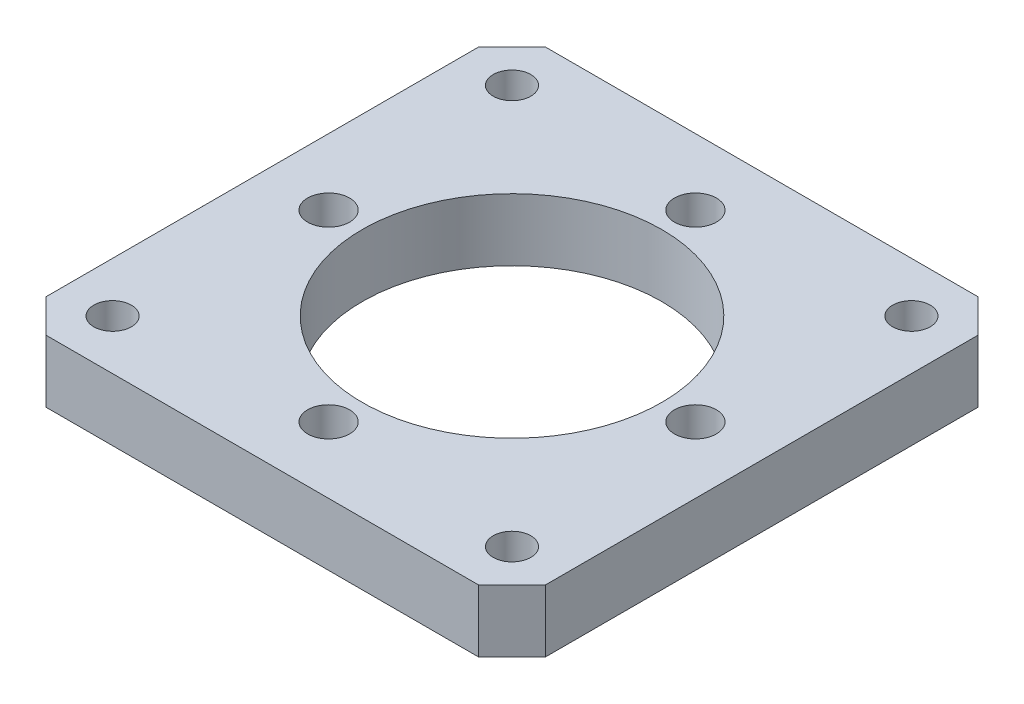
from build123d import *

# Parameters (mm, degrees)
SKETCH1_W           = 38.1
SKETCH1_H           = 38.1
SKETCH1_R           = 11.43
BOSS_EXTRUDE1_DEPTH = 4.7625
SKETCH2_R           = 1.6002
SKETCH2_R_2         = 1.4351
CUT_EXTRUDE1_DEPTH  = 28.358479604
CIRPATTERN1_COUNT   = 4
CHAMFER1_SIZE       = 2.54


with BuildPart() as part:
    # Sketch1 → Boss-Extrude1 (new body)
    with BuildSketch(Plane(origin=(0, 0, 0), x_dir=(1, 0, 0), z_dir=(0, 1, 0))):
        Rectangle(SKETCH1_W, SKETCH1_H)
        with Locations(Location((0, 0, 0), (0, 0, 90))):
            Circle(SKETCH1_R, mode=Mode.SUBTRACT)
    extrude(amount=BOSS_EXTRUDE1_DEPTH)

    # Sketch2 → Cut-Extrude1 (cut, through all)
    with BuildSketch(Plane(origin=(0, 4.7625, 0), x_dir=(1, 0, 0), z_dir=(0, 1, 0))):
        with Locations(Location((0, 13.9954, 0), (0, 0, 270))):
            Circle(SKETCH2_R)
        with Locations(Location((15.24, 15.24, 0), (0, 0, 270))):
            Circle(SKETCH2_R_2)
    cut_extrude1 = extrude(amount=-CUT_EXTRUDE1_DEPTH, mode=Mode.SUBTRACT)

    # CirPattern1: Cut-Extrude1 ×4 about axis
    cirpattern1_axis = Axis((0, 0, 0), (0, 1, 0))
    for i in range(1, CIRPATTERN1_COUNT):
        add(cut_extrude1.rotate(cirpattern1_axis, i * 360 / CIRPATTERN1_COUNT), mode=Mode.SUBTRACT)

    # Chamfer1
    chamfer1_edges = [part.edges().sort_by_distance(p)[0] for p in [
        (19.05, 2.38125, 19.05),
        (-19.05, 2.38125, 19.05),
        (-19.05, 2.38125, -19.05),
        (19.05, 2.38125, -19.05),
    ]]
    chamfer(chamfer1_edges, length=CHAMFER1_SIZE)


solid = part.part
